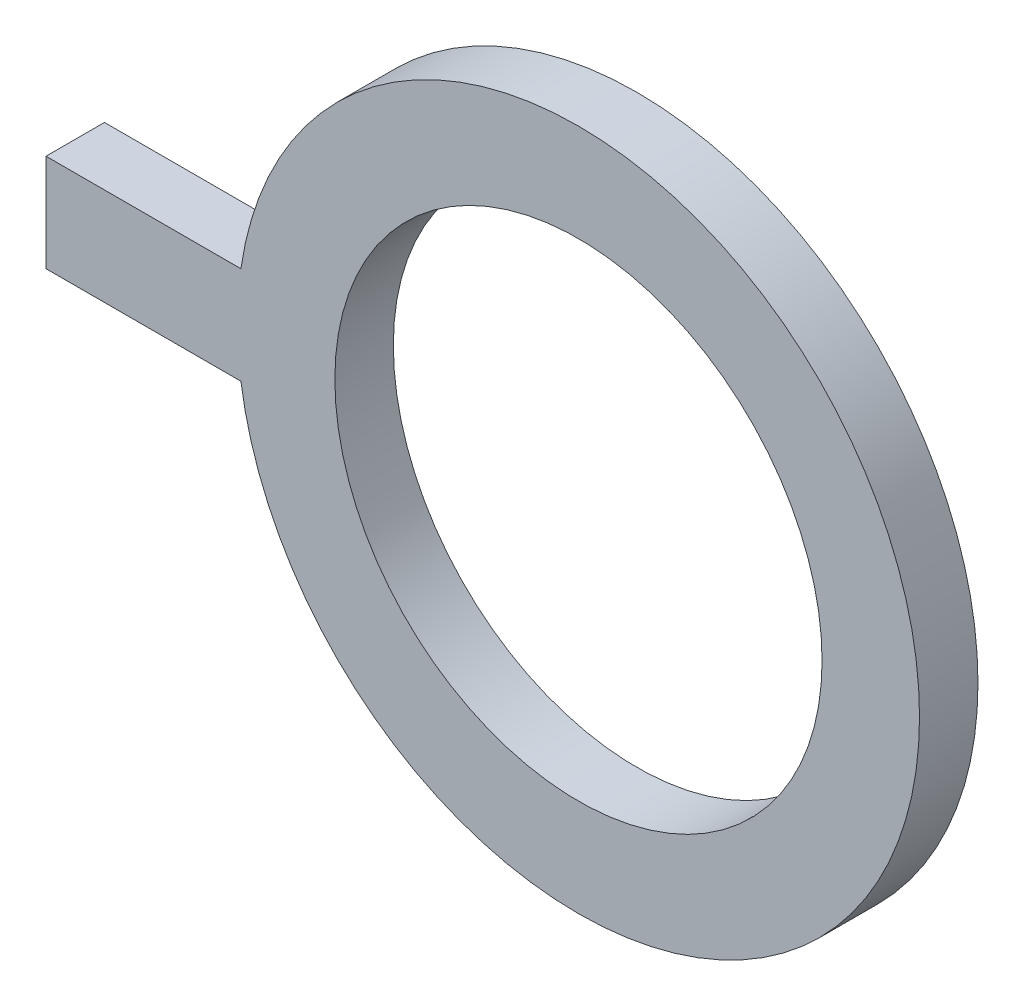
from build123d import *

# Parameters (mm, degrees)
SKETCH1_R           = 25
BOSS_EXTRUDE1_DEPTH = 6


with BuildPart() as part:
    # Sketch1 → Boss-Extrude1 (new body)
    with BuildSketch(Plane(origin=(0, 0, 0), x_dir=(0, 1, 0), z_dir=(0, 0, 1))):
        with BuildLine():
            Line((5, 34.641016151), (5, 54.641016151))
            Line((5, 54.641016151), (-5, 54.641016151))
            Line((-5, 54.641016151), (-5, 34.641016151))
            ThreePointArc((-5, 34.641016151), (0, -35), (5, 34.641016151))
        make_face()
        with Locations(Location((0, 0, 0), (0, 0, 270))):
            Circle(SKETCH1_R, mode=Mode.SUBTRACT)
    extrude(amount=BOSS_EXTRUDE1_DEPTH)


solid = part.part
